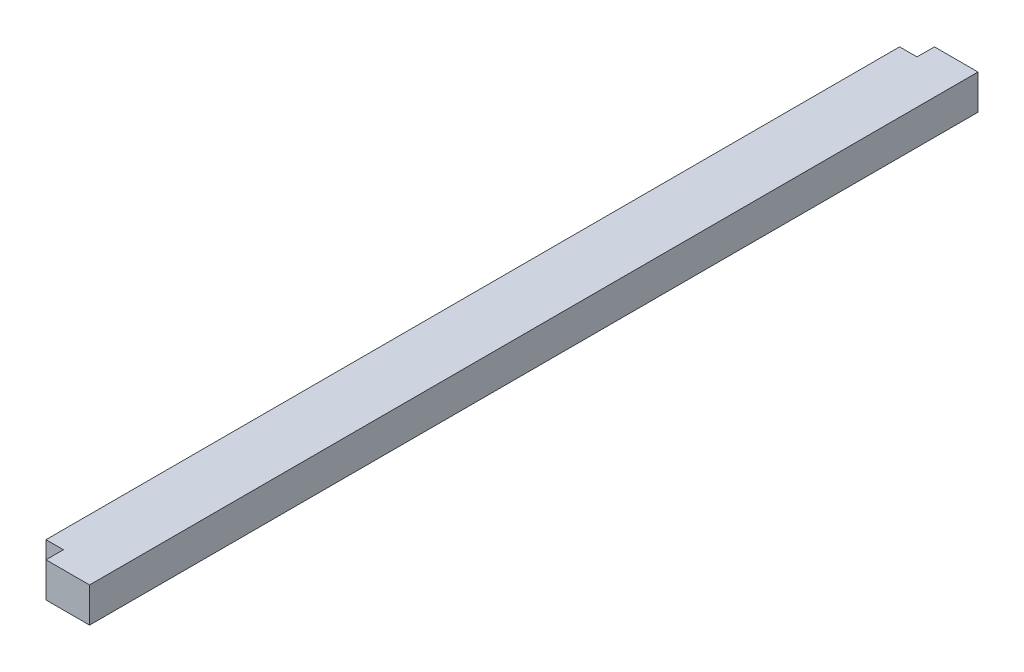
from build123d import *

# Parameters (mm, degrees)
EXTRUDE_1_DEPTH     = 510
SKETCH_2_W          = 10
SKETCH_2_H          = 10
CUT_EXTRUDE_1_DEPTH = 512.590656678


with BuildPart() as part:
    # Эскиз1 → Бобышка-Вытянуть1 (new body)
    with BuildSketch(Plane(origin=(0, 0, 0), x_dir=(1, 0, 0), z_dir=(0, 0, -1))):
        Polygon((0, 10), (10, 10), (10, 20), (35, 20), (35, 0), (0, 0), align=None)
    extrude(amount=EXTRUDE_1_DEPTH)

    # Эскиз2 → Вырез-Вытянуть1 (cut, through all)
    with BuildSketch(Plane(origin=(0, 0, 0), x_dir=(1, 0, 0), z_dir=(0, 1, 0))):
        with Locations((5, 5)):
            Rectangle(SKETCH_2_W, SKETCH_2_H)
        with Locations((5, 505)):
            Rectangle(SKETCH_2_W, SKETCH_2_H)
    extrude(amount=-CUT_EXTRUDE_1_DEPTH, mode=Mode.SUBTRACT)


solid = part.part
